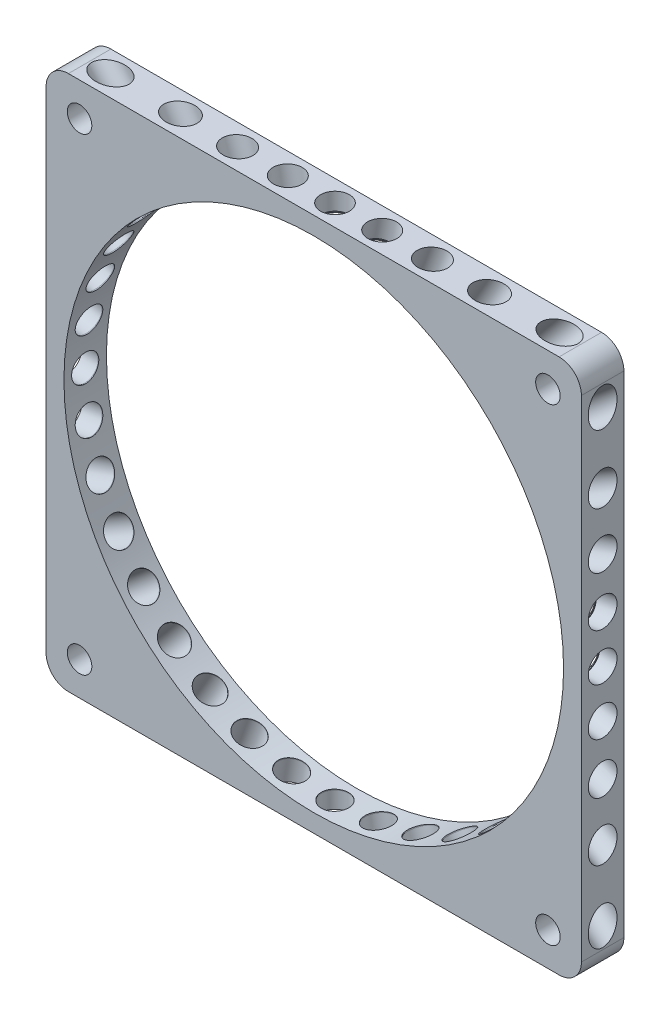
from build123d import *

# Parameters (mm, degrees)
SKETCH1_R           = 56
SKETCH1_R_2         = 2.75
BOSS_EXTRUDE1_DEPTH = 4.7625
CUT_EXTRUDE2_START  = -131.685429204
SKETCH3_R           = 3.048
CUT_EXTRUDE2_DEPTH  = 144.385429204
CIRPATTERN7_COUNT   = 36
SKETCH5_R           = 3.225
CUT_EXTRUDE4_DEPTH  = 25
CIRPATTERN8_COUNT   = 36


with BuildPart() as part:
    # Sketch1 → Boss-Extrude1 (new, symmetric)
    with BuildSketch(Plane.XY):
        with BuildLine():
            Line((-55, -60), (55, -60))
            ThreePointArc((55, -60), (58.535533906, -58.535533906), (60, -55))
            Line((60, -55), (60, 55))
            ThreePointArc((60, 55), (58.535533906, 58.535533906), (55, 60))
            Line((55, 60), (-55, 60))
            ThreePointArc((-55, 60), (-58.535533906, 58.535533906), (-60, 55))
            Line((-60, 55), (-60, -55))
            ThreePointArc((-60, -55), (-58.535533906, -58.535533906), (-55, -60))
        make_face()
        Circle(SKETCH1_R, mode=Mode.SUBTRACT)
        with Locations((-52.5, 52.5)):
            Circle(SKETCH1_R_2, mode=Mode.SUBTRACT)
        with Locations((52.5, 52.5)):
            Circle(SKETCH1_R_2, mode=Mode.SUBTRACT)
        with Locations((52.5, -52.5)):
            Circle(SKETCH1_R_2, mode=Mode.SUBTRACT)
        with Locations((-52.5, -52.5)):
            Circle(SKETCH1_R_2, mode=Mode.SUBTRACT)
    extrude(amount=BOSS_EXTRUDE1_DEPTH, both=True)

    # Sketch3 → Cut-Extrude2 (cut)
    with BuildSketch(Plane.XZ.offset(-56).offset(CUT_EXTRUDE2_START)):
        Circle(SKETCH3_R)
    cut_extrude2 = extrude(amount=CUT_EXTRUDE2_DEPTH, mode=Mode.SUBTRACT)

    # CirPattern7: Cut-Extrude2 ×36 about axis
    cirpattern7_axis = Axis((0, 0, 4.7625), (0, 0, -1))
    for i in range(1, CIRPATTERN7_COUNT):
        add(cut_extrude2.rotate(cirpattern7_axis, i * 360 / CIRPATTERN7_COUNT), mode=Mode.SUBTRACT)

    # Sketch5 → Cut-Extrude4 (cut)
    with BuildSketch(Plane(origin=(0, 56.127, 0), x_dir=(0.10764567173111145, 0, 0.9941893226933981), z_dir=(0, -1, 0))):
        Circle(SKETCH5_R)
    cut_extrude4 = extrude(amount=-CUT_EXTRUDE4_DEPTH, mode=Mode.SUBTRACT)

    # CirPattern8: Cut-Extrude4 ×36 about axis
    cirpattern8_axis = Axis((0, 0, 4.7625), (0, 0, -1))
    for i in range(1, CIRPATTERN8_COUNT):
        add(cut_extrude4.rotate(cirpattern8_axis, i * 360 / CIRPATTERN8_COUNT), mode=Mode.SUBTRACT)


solid = part.part
